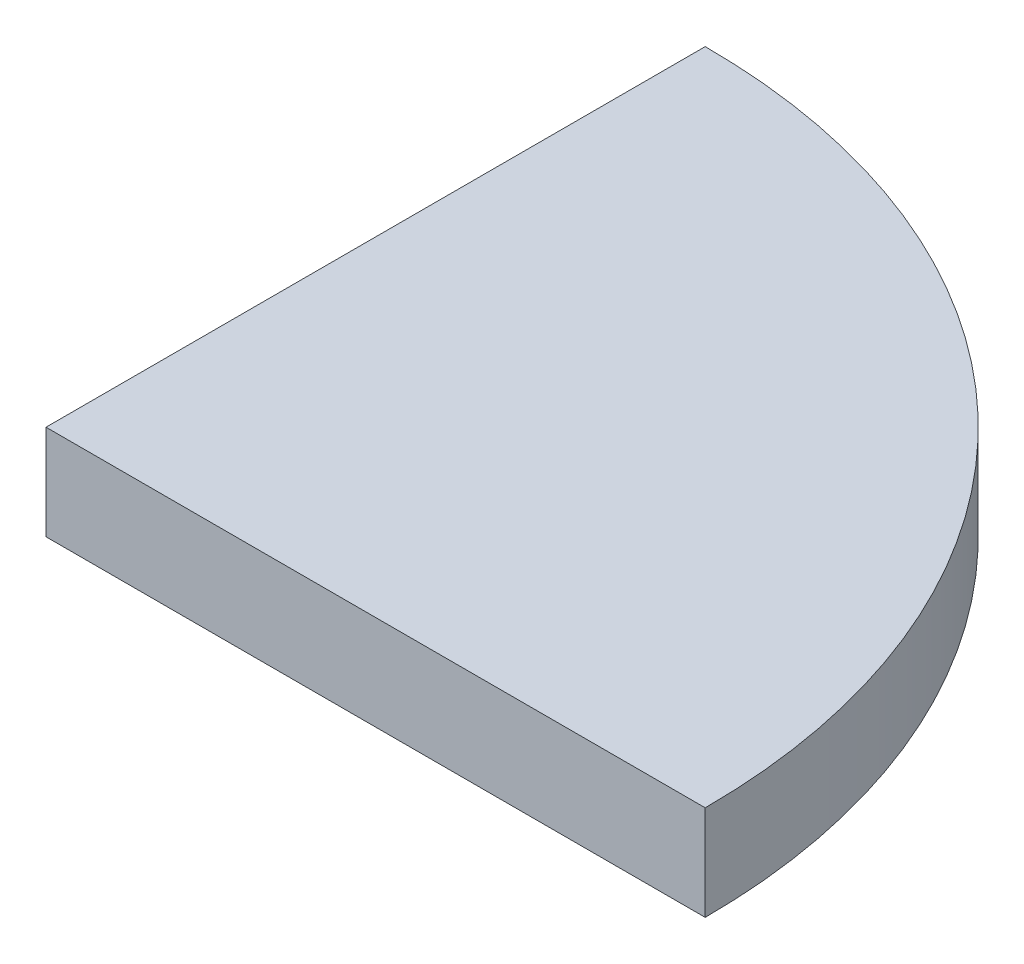
from build123d import *

# Parameters (mm, degrees)
BOSS_EXTRU_1_DEPTH = 36


with BuildPart() as part:
    # Esquisse3 → Boss.-Extru.1 (new body)
    with BuildSketch(Plane(origin=(0, 0, 0), x_dir=(1, 0, 0), z_dir=(0, 1, 0))):
        with BuildLine():
            Line((-49.881564549, -26.407887114), (200.118435451, -26.407887114))
            ThreePointArc((200.118435451, -26.407887114), (126.895130748, 150.368808183), (-49.881564549, 223.592112886))
            Line((-49.881564549, 223.592112886), (-49.881564549, -26.407887114))
        make_face()
    extrude(amount=BOSS_EXTRU_1_DEPTH)


solid = part.part
